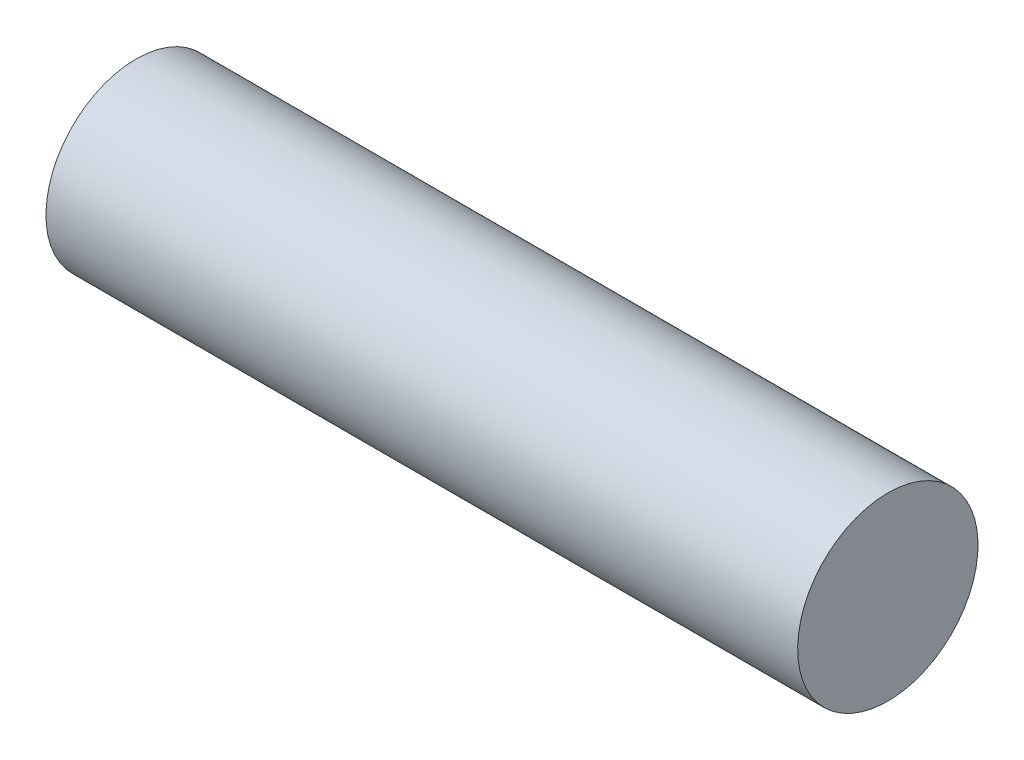
from build123d import *

# Parameters (mm, degrees)
SKETCH1_W      = 50
SKETCH1_H      = 6
REVOLVE1_ANGLE = 359.999999589


with BuildPart() as part:
    # Sketch1 → Revolve1 (revolve)
    with BuildSketch(Plane.XY):
        with Locations((25, 3)):
            Rectangle(SKETCH1_W, SKETCH1_H)
    revolve(axis=Axis((0, 0, 0), (1, 0, 0)), revolution_arc=REVOLVE1_ANGLE)


solid = part.part
